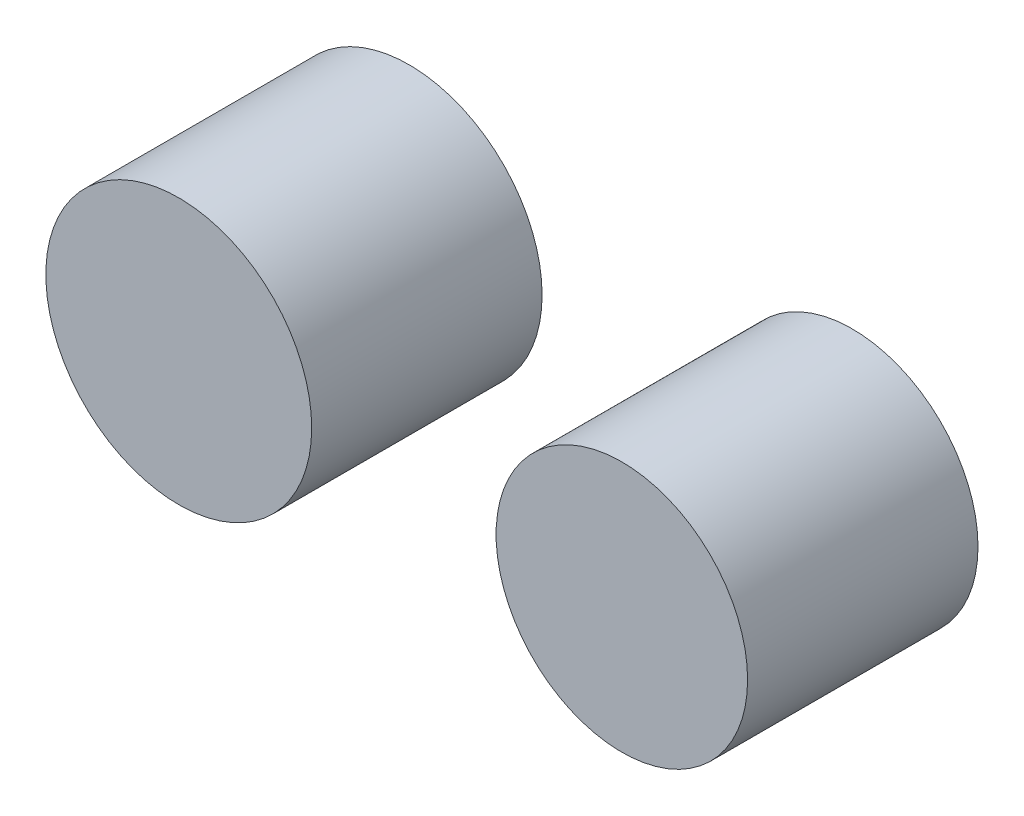
from build123d import *

# Parameters (mm, degrees)
SKIZZE1_R                         = 1.5
AUFSATZ_LINEAR_AUSTRAGEN1_DEPTH   = 2.6
SKIZZE1_R_2                       = 1.41911553
AUFSATZ_LINEAR_AUSTRAGEN1_2_DEPTH = 2.6


with BuildPart() as part:
    # Skizze1 → Aufsatz-Linear austragen1 (new body)
    with BuildSketch(Plane.XY):
        Circle(SKIZZE1_R)
    extrude(amount=AUFSATZ_LINEAR_AUSTRAGEN1_DEPTH)


with BuildPart() as body_2:
    # Skizze1 → Aufsatz-Linear austragen1 2 (new body)
    with BuildSketch(Plane.XY):
        with Locations((5, 0)):
            Circle(SKIZZE1_R_2)
    extrude(amount=AUFSATZ_LINEAR_AUSTRAGEN1_2_DEPTH)


solid = Compound([part.part, body_2.part])
